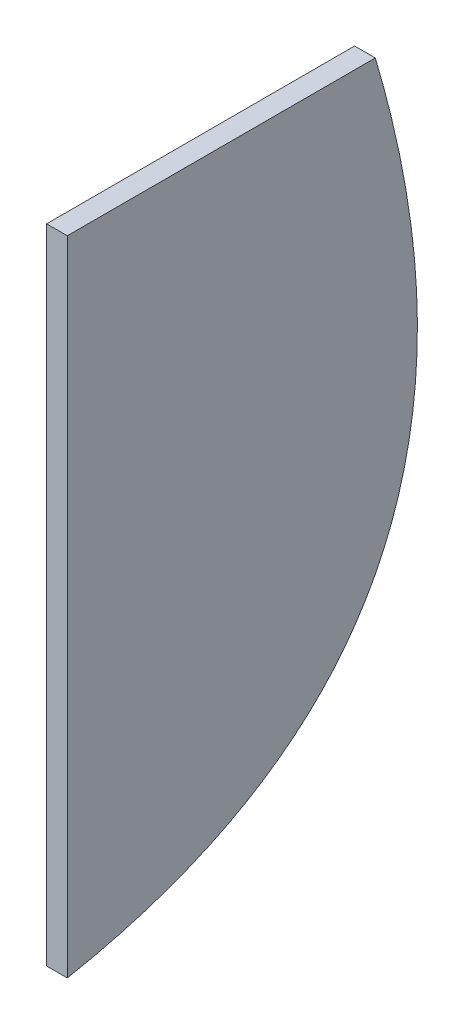
from build123d import *

# Parameters (mm, degrees)
BOSS_EXTRUDE1_DEPTH = 40


with BuildPart() as part:
    # Sketch1 → Boss-Extrude1 (new body)
    with BuildSketch(Plane(origin=(0, 0, 0), x_dir=(0, 0, -1), z_dir=(1, 0, 0))):
        with BuildLine():
            Line((-376.591845046, -103.873475652), (-376.591845046, -621.126524348))
            add(Edge.make_bspline(
                [(218.565167142, 621.126524348), (534.61852295, -449.321139123), (-376.591845046, -621.126524348)],
                knots=[0, 0, 0, 1, 1, 1], degree=2))
            Line((218.565167142, 621.126524348), (-376.591845046, 621.126524348))
            Line((-376.591845046, 621.126524348), (-376.591845046, -103.873475652))
        make_face()
    extrude(amount=BOSS_EXTRUDE1_DEPTH)


solid = part.part
